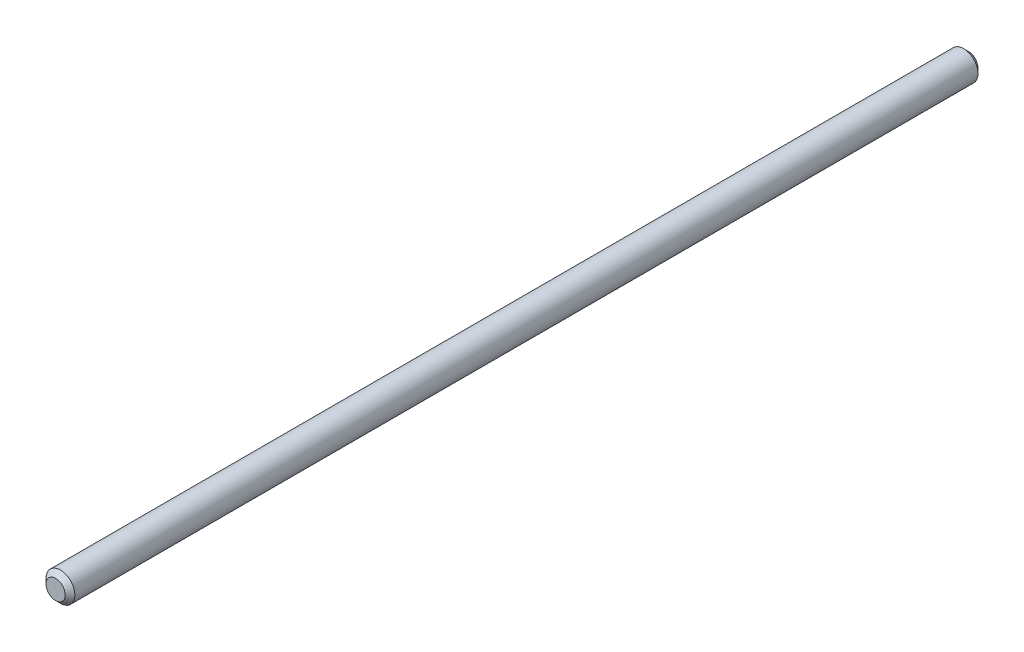
from build123d import *

# Parameters (mm, degrees)
SKETCH1_R           = 3
BOSS_EXTRUDE1_DEPTH = 94.85
CHAMFER1_SIZE       = 1


with BuildPart() as part:
    # Sketch1 → Boss-Extrude1 (new, symmetric)
    with BuildSketch(Plane.XY):
        Circle(SKETCH1_R)
    extrude(amount=BOSS_EXTRUDE1_DEPTH, both=True)

    # Chamfer1
    chamfer1_edges = [part.edges().sort_by_distance(p)[0] for p in [
        (-3, 0, -94.85),
        (-3, 0, 94.85),
    ]]
    chamfer(chamfer1_edges, length=CHAMFER1_SIZE)


solid = part.part
